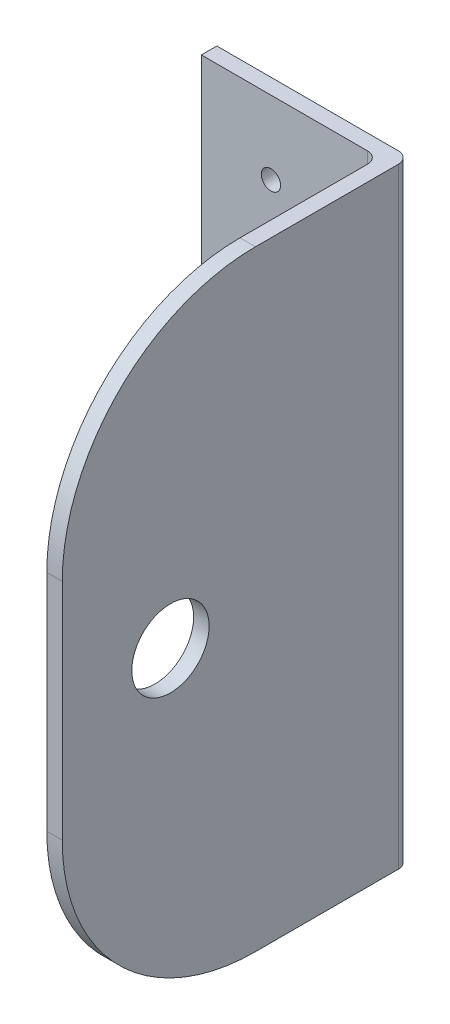
from build123d import *

# Parameters (mm, degrees)
BOSS_EXTRUDE1_DEPTH = 79
SKETCH2_R           = 5
CUT_EXTRUDE1_DEPTH  = 95.292099351
CUT_EXTRUDE3_DEPTH  = 95.292099351
FILLET1_R           = 1.5
SKETCH5_R           = 1.25
CUT_EXTRUDE4_DEPTH  = 95.292099351


with BuildPart() as part:
    # Sketch1 → Boss-Extrude1 (new body)
    with BuildSketch(Plane(origin=(0, 0, 0), x_dir=(1, 0, 0), z_dir=(0, 1, 0))):
        Polygon((0, 0), (0, -2), (23, -2), (23, -45), (25, -45), (25, 0), align=None)
    extrude(amount=BOSS_EXTRUDE1_DEPTH)

    # Sketch2 → Cut-Extrude1 (cut, through all)
    with BuildSketch(Plane(origin=(25, 0, 0), x_dir=(0, 0, -1), z_dir=(1, 0, 0))):
        with Locations((-31, 39.5)):
            Circle(SKETCH2_R)
    extrude(amount=-CUT_EXTRUDE1_DEPTH, mode=Mode.SUBTRACT)

    # Sketch3 → Cut-Extrude3 (cut, through all)
    with BuildSketch(Plane(origin=(25, 0, 0), x_dir=(0, 0, -1), z_dir=(1, 0, 0))):
        Polygon((-56.02971798, 54), (-45, 54), (-45, 79), (-20, 79), (-20, 83.569029918), (-56.02971798, 83.569029918), align=None)
        Polygon((-45, 0), (-45, 25), (-50.640365422, 25), (-50.640365422, -10.402653787), (-20, -10.402653787), (-20, 0), align=None)
        with BuildLine():
            ThreePointArc((-20, 0), (-37.67766953, 7.32233047), (-45, 25))
            Line((-45, 25), (-45, 0))
            Line((-45, 0), (-20, 0))
        make_face()
        with BuildLine():
            Line((-45, 79), (-45, 54))
            ThreePointArc((-45, 54), (-37.67766953, 71.67766953), (-20, 79))
            Line((-20, 79), (-45, 79))
        make_face()
    extrude(amount=-CUT_EXTRUDE3_DEPTH, mode=Mode.SUBTRACT)

    # Fillet1
    fillet1_edges = [part.edges().sort_by_distance(p)[0] for p in [
        (25, 39.5, 0),
        (23, 39.5, 2),
    ]]
    fillet(fillet1_edges, radius=FILLET1_R)

    # Sketch5 → Cut-Extrude4 (cut, through all)
    with BuildSketch(Plane(origin=(0, 0, 0), x_dir=(-1, 0, 0), z_dir=(0, 0, -1))):
        with Locations((-18, 69.5)):
            Circle(SKETCH5_R)
        with Locations((-9, 69.5)):
            Circle(SKETCH5_R)
        with Locations((-9, 9.5)):
            Circle(SKETCH5_R)
        with Locations((-18, 9.5)):
            Circle(SKETCH5_R)
    extrude(amount=-CUT_EXTRUDE4_DEPTH, mode=Mode.SUBTRACT)


solid = part.part
